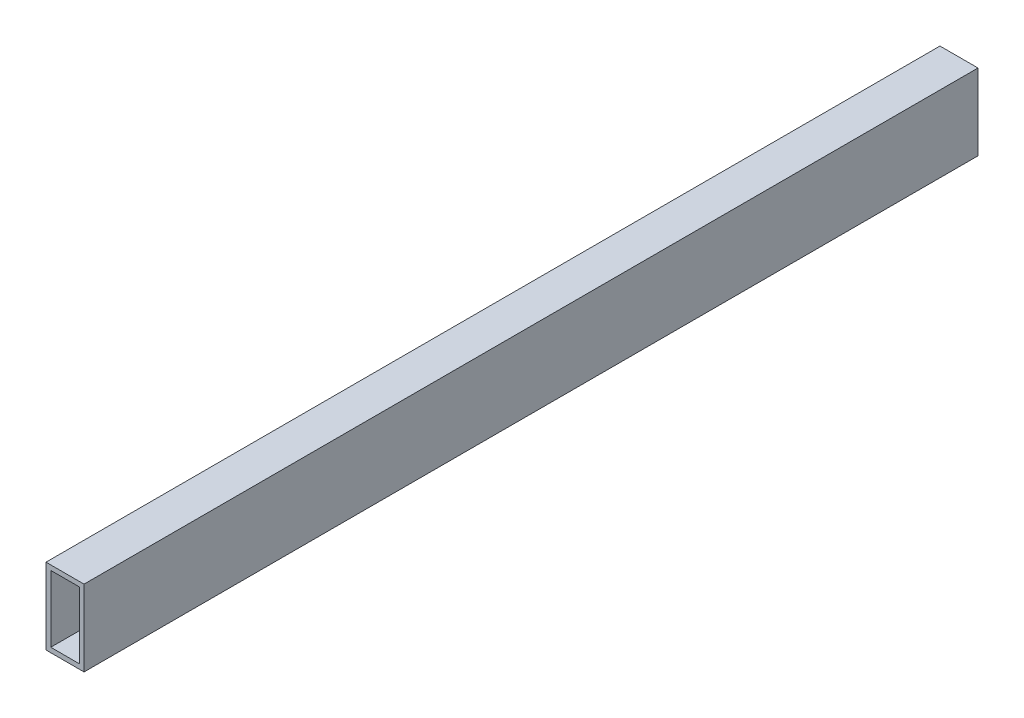
from build123d import *

# Parameters (mm, degrees)
SKETCH1_W           = 25.4
SKETCH1_H           = 50.8
SKETCH1_W_2         = 19.05
SKETCH1_H_2         = 44.45
BOSS_EXTRUDE1_DEPTH = 596.9


with BuildPart() as part:
    # Sketch1 → Boss-Extrude1 (new body)
    with BuildSketch(Plane.XY):
        Rectangle(SKETCH1_W, SKETCH1_H)
        Rectangle(SKETCH1_W_2, SKETCH1_H_2, mode=Mode.SUBTRACT)
    extrude(amount=BOSS_EXTRUDE1_DEPTH)


solid = part.part
